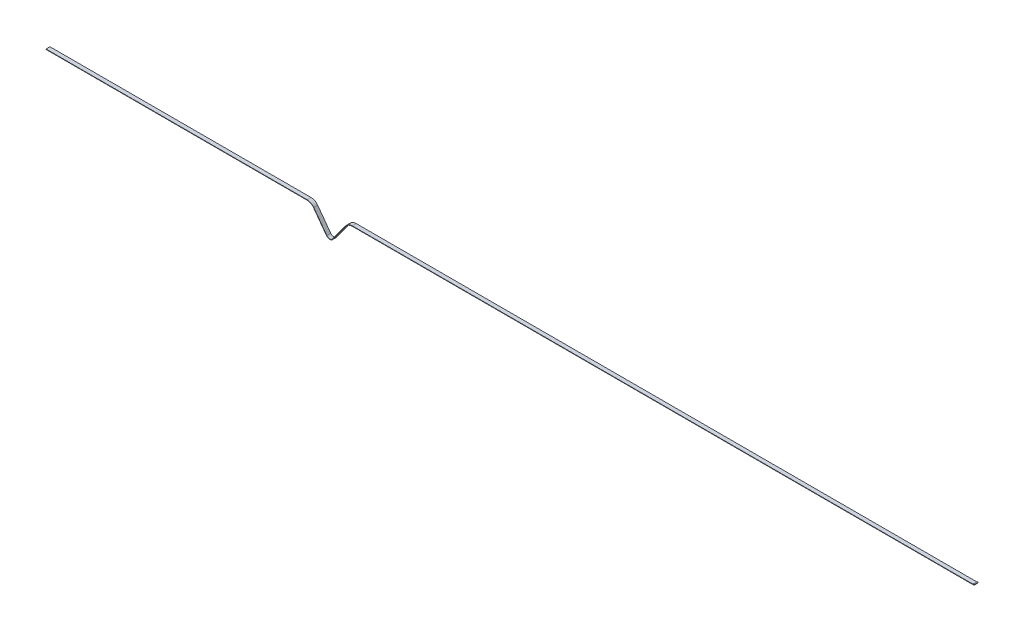
from build123d import *

# Parameters (mm, degrees)
SKETCH1_W           = 6
SKETCH1_H           = 0.63
BOSS_EXTRUDE1_DEPTH = 6


with BuildPart() as part:
    # Sweep1: sweep along a path in Sketch2
    with BuildLine(Plane.XY) as sweep1_path:
        Line((0, 0), (-953.012225303, 0))
        ThreePointArc((-953.012225303, 0), (-958.410892209, -1.28900119), (-962.644891657, -4.877925416))
        Line((-962.644891657, -4.877925416), (-982.657071209, -32.135931021))
        ThreePointArc((-982.657071209, -32.135931021), (-987.582225303, -34.63), (-992.507379397, -32.135931021))
        Line((-992.507379397, -32.135931021), (-1012.519558949, -4.877925416))
        ThreePointArc((-1012.519558949, -4.877925416), (-1016.753558397, -1.28900119), (-1022.152225303, 0))
        Line((-1022.152225303, 0), (-1422.4, 0))
    # Sketch1 → Sweep1 (sweep)
    with BuildSketch(Plane(origin=(0, 0, 0), x_dir=(0, 0, -1), z_dir=(1, 0, 0))):
        with Locations((3, 0.315)):
            Rectangle(SKETCH1_W, SKETCH1_H)
    sweep(path=sweep1_path.line)

    # Sketch3 → Boss-Extrude1 (add, through all)
    with BuildSketch(Plane.XY):
        with BuildLine():
            Line((-1.5, 0.63), (-1.5, 0))
            Line((-1.5, 0), (0, 0))
            Line((0, 0), (0, 0.63))
            ThreePointArc((0, 0.63), (-0.75, 1.38), (-1.5, 0.63))
        make_face()
    extrude(amount=-BOSS_EXTRUDE1_DEPTH)


solid = part.part
